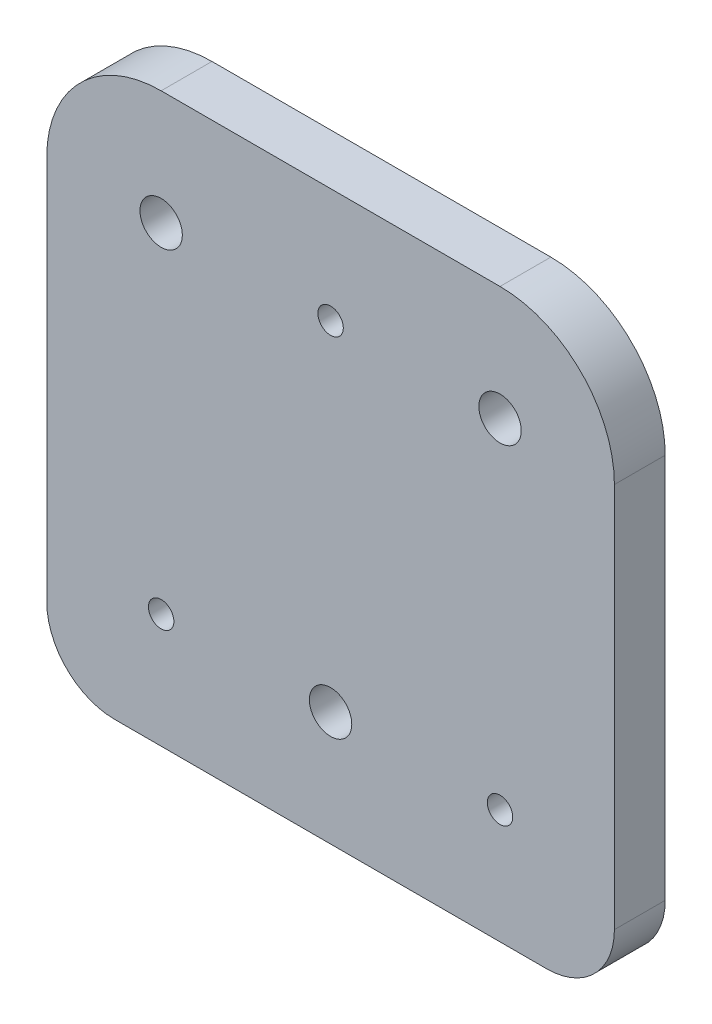
from build123d import *

# Parameters (mm, degrees)
ESBO_O1_R                = 2.5
RESSALTO_EXTRUS_O1_DEPTH = 6
ESBO_O2_W                = 13.5
ESBO_O2_H                = 13.5
RESSALTO_EXTRUS_O2_DEPTH = 6
FILETE1_R                = 8
ESBO_O3_R                = 1.5
CORTE_EXTRUS_O1_DEPTH    = 6


with BuildPart() as part:
    # Esboço1 → Ressalto-extrusão1 (new body)
    with BuildSketch(Plane.XY):
        with BuildLine():
            Line((-20, 33.5), (20, 33.5))
            ThreePointArc((20, 33.5), (29.545941546, 29.545941546), (33.5, 20))
            Line((33.5, 20), (33.5, -20))
            ThreePointArc((33.5, -20), (29.545941546, -29.545941546), (20, -33.5))
            Line((20, -33.5), (-20, -33.5))
            ThreePointArc((-20, -33.5), (-29.545941546, -29.545941546), (-33.5, -20))
            Line((-33.5, -20), (-33.5, 20))
            ThreePointArc((-33.5, 20), (-29.545941546, 29.545941546), (-20, 33.5))
        make_face()
        with Locations((-20, 20)):
            Circle(ESBO_O1_R, mode=Mode.SUBTRACT)
        with Locations((20, 20)):
            Circle(ESBO_O1_R, mode=Mode.SUBTRACT)
        with Locations((0, -20)):
            Circle(ESBO_O1_R, mode=Mode.SUBTRACT)
    extrude(amount=RESSALTO_EXTRUS_O1_DEPTH)

    # Esboço2 → Ressalto-extrusão2 (add)
    with BuildSketch(Plane(origin=(0, 0, 0), x_dir=(-1, 0, 0), z_dir=(0, 0, -1))):
        with Locations((-26.75, -26.75)):
            Rectangle(ESBO_O2_W, ESBO_O2_H)
        with Locations((26.75, -26.75)):
            Rectangle(ESBO_O2_W, ESBO_O2_H)
    extrude(amount=-RESSALTO_EXTRUS_O2_DEPTH)

    # Filete1
    filete1_edges = [part.edges().sort_by_distance(p)[0] for p in [
        (33.5, -33.5, 3),
        (-33.5, -33.5, 3),
    ]]
    fillet(filete1_edges, radius=FILETE1_R)

    # Esboço3 → Corte-extrusão1 (cut)
    with BuildSketch(Plane(origin=(0, 0, 0), x_dir=(-1, 0, 0), z_dir=(0, 0, -1))):
        with Locations((0, 20)):
            Circle(ESBO_O3_R)
        with Locations((20, -20)):
            Circle(ESBO_O3_R)
        with Locations((-20, -20)):
            Circle(ESBO_O3_R)
    extrude(amount=-CORTE_EXTRUS_O1_DEPTH, mode=Mode.SUBTRACT)


solid = part.part
